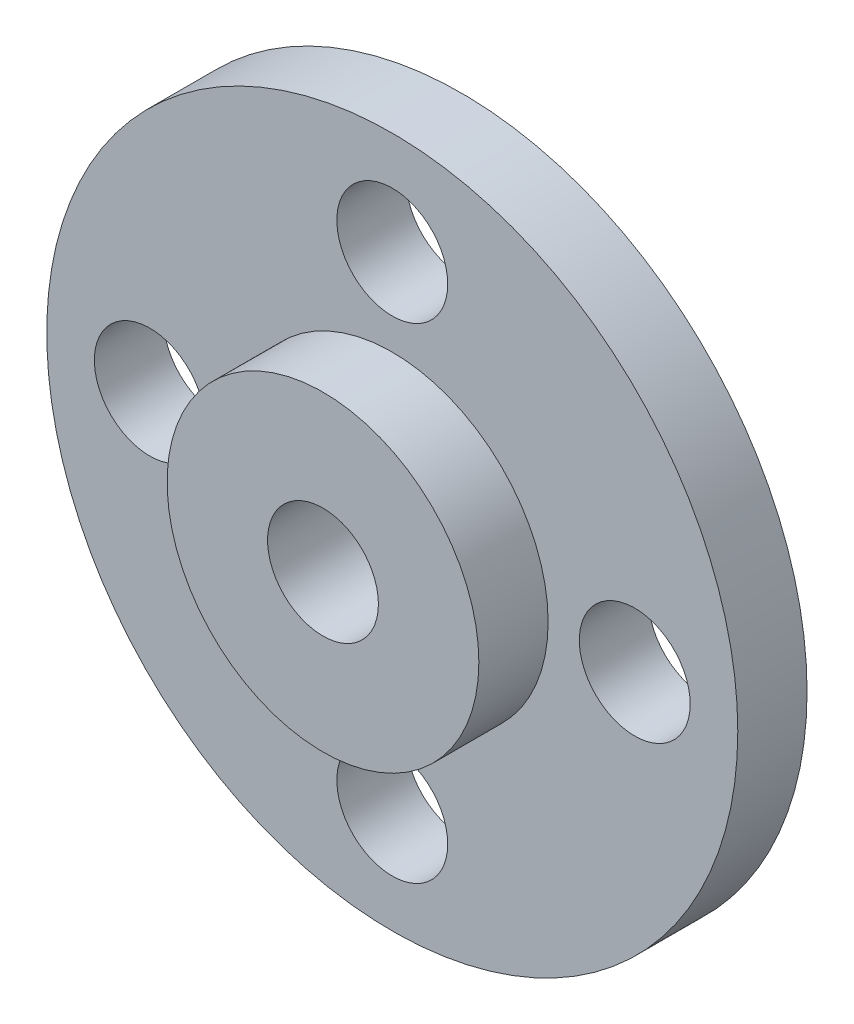
from build123d import *

# Parameters (mm, degrees)
SKETCH_1_R          = 9.975
EXTRUDE_1_DEPTH     = 2
SKETCH_2_R          = 4.5
EXTRUDE_2_DEPTH     = 2
SKETCH_3_R          = 1.6
CUT_EXTRUDE_1_DEPTH = 15.662920923
SKETCH_4_R          = 1.6
CUT_EXTRUDE_2_DEPTH = 15.247850715


with BuildPart() as part:
    # ｽｹｯﾁ1 → ﾎﾞｽ - 押し出し1 (new body)
    with BuildSketch(Plane.XY):
        Circle(SKETCH_1_R)
    extrude(amount=EXTRUDE_1_DEPTH)

    # ｽｹｯﾁ2 → ﾎﾞｽ - 押し出し2 (add)
    with BuildSketch(Plane.XY.offset(2)):
        Circle(SKETCH_2_R)
    extrude(amount=EXTRUDE_2_DEPTH)

    # ｽｹｯﾁ3 → ｶｯﾄ - 押し出し1 (cut, through all)
    with BuildSketch(Plane.XY.offset(4)):
        Circle(SKETCH_3_R)
    extrude(amount=-CUT_EXTRUDE_1_DEPTH, mode=Mode.SUBTRACT)

    # ｽｹｯﾁ4 → ｶｯﾄ - 押し出し2 (cut, through all)
    with BuildSketch(Plane.XY.offset(2)):
        with Locations((0, 7)):
            Circle(SKETCH_4_R)
        with Locations((0, -7)):
            Circle(SKETCH_4_R)
        with Locations((-7, 0)):
            Circle(SKETCH_4_R)
        with Locations((7, 0)):
            Circle(SKETCH_4_R)
    extrude(amount=-CUT_EXTRUDE_2_DEPTH, mode=Mode.SUBTRACT)


solid = part.part
